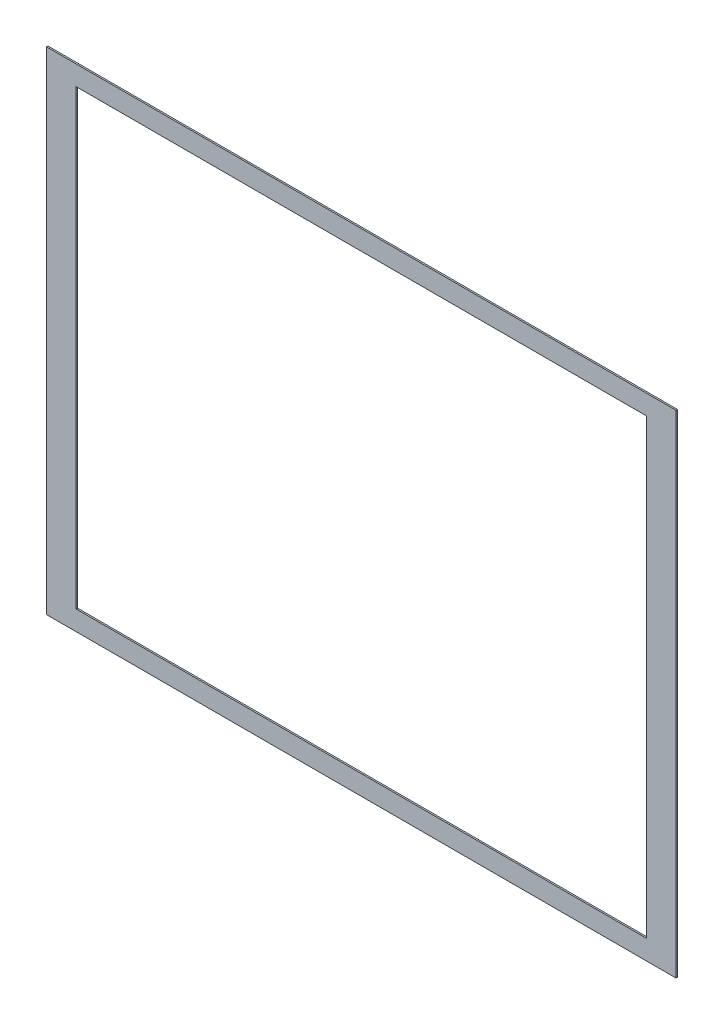
from build123d import *

# Parameters (mm, degrees)
OVEN_PANEL_KESME_1_START = 38.5
SKETCH1_W                = 640
SKETCH1_H                = 500
OVEN_PANEL_KESME_1_DEPTH = 1.5
OVEN_PANEL_KESME_2_START = 37.5
SKETCH2_W                = 580
SKETCH2_H                = 460
OVEN_PANEL_KESME_2_DEPTH = 3.5


with BuildPart() as part:
    # Sketch1 → OVEN_panel_kesme_1 (new body)
    with BuildSketch(Plane.XY.offset(OVEN_PANEL_KESME_1_START)):
        with Locations((350, 570)):
            Rectangle(SKETCH1_W, SKETCH1_H)
    extrude(amount=OVEN_PANEL_KESME_1_DEPTH)

    # Sketch2 → OVEN_panel_kesme_2 (cut)
    with BuildSketch(Plane.XY.offset(OVEN_PANEL_KESME_2_START)):
        with Locations((350, 570)):
            Rectangle(SKETCH2_W, SKETCH2_H)
    extrude(amount=OVEN_PANEL_KESME_2_DEPTH, mode=Mode.SUBTRACT)


solid = part.part
